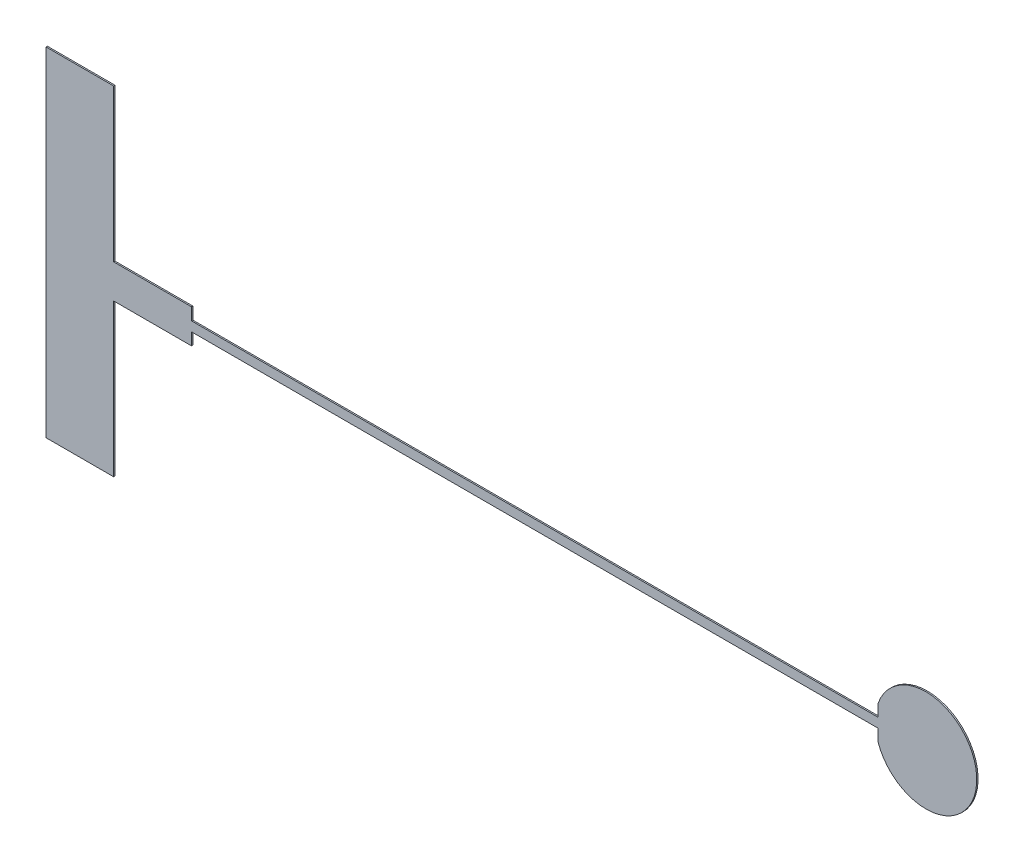
from build123d import *

# Parameters (mm, degrees)
BOSS_EXTRUDE1_DEPTH = 20
SKETCH2_W           = 1000
SKETCH2_H           = 2250
CUT_EXTRUDE1_DEPTH  = 12993.801853334
CUT_EXTRUDE4_DEPTH  = 12993.801853334
SKETCH5_W           = 11500
SKETCH5_H           = 500
BOSS_EXTRUDE2_DEPTH = 20
SKETCH7_W           = 10142.893218813
SKETCH7_H           = 180
CUT_EXTRUDE5_DEPTH  = 12993.801853334


with BuildPart() as part:
    # Sketch1 → Boss-Extrude1 (new body)
    with BuildSketch(Plane.XY):
        with BuildLine():
            Line((1000, 250), (5000, 250))
            Line((5000, 250), (5000, 125))
            Line((5000, 125), (9000, 125))
            Line((9000, 125), (9000, 100))
            Line((9000, 100), (11256.696562634, 100))
            ThreePointArc((11256.696562634, 100), (12750, 0), (11256.696562634, -100))
            Line((11256.696562634, -100), (9000, -100))
            Line((9000, -100), (9000, -125))
            Line((9000, -125), (5000, -125))
            Line((5000, -125), (5000, -250))
            Line((5000, -250), (1000, -250))
            Line((1000, -250), (1000, -2500))
            Line((1000, -2500), (-1000, -2500))
            Line((-1000, -2500), (-1000, 2500))
            Line((-1000, 2500), (1000, 2500))
            Line((1000, 2500), (1000, 250))
        make_face()
    extrude(amount=-BOSS_EXTRUDE1_DEPTH)

    # Sketch2 → Cut-Extrude1 (cut, through all)
    with BuildSketch(Plane.XY):
        with Locations((500, 1375)):
            Rectangle(SKETCH2_W, SKETCH2_H)
        with Locations((500, -1375)):
            Rectangle(SKETCH2_W, SKETCH2_H)
    extrude(amount=-CUT_EXTRUDE1_DEPTH, mode=Mode.SUBTRACT)

    # Sketch3 → Cut-Extrude4 (cut, through all)
    with BuildSketch(Plane.XY):
        Polygon((1500, -250), (3250, -250), (5000, -250), (5000, -150), (3250, -150), (3250, -200), (1500, -200), align=None)
    cut_extrude4 = extrude(amount=-CUT_EXTRUDE4_DEPTH, mode=Mode.SUBTRACT)

    # Mirror1: Cut-Extrude4 across plane
    add(cut_extrude4.mirror(Plane.ZX), mode=Mode.SUBTRACT)

    # Sketch5 → Boss-Extrude2 (add)
    with BuildSketch(Plane.XY):
        with Locations((5750, 0)):
            Rectangle(SKETCH5_W, SKETCH5_H)
    extrude(amount=-BOSS_EXTRUDE2_DEPTH)

    # Sketch7 → Cut-Extrude5 (cut, through all)
    with BuildSketch(Plane.XY):
        with Locations((6221.446609407, 160)):
            Rectangle(SKETCH7_W, SKETCH7_H)
    cut_extrude5 = extrude(amount=-CUT_EXTRUDE5_DEPTH, mode=Mode.SUBTRACT)

    # Mirror2: Cut-Extrude5 across plane
    add(cut_extrude5.mirror(Plane.ZX), mode=Mode.SUBTRACT)


solid = part.part
